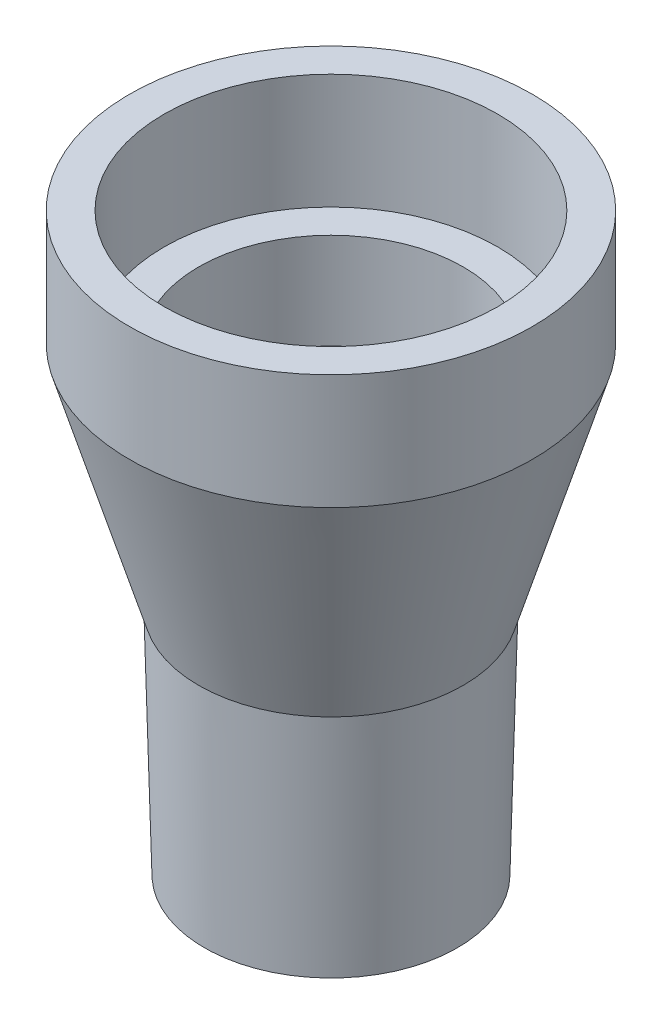
from build123d import *


with BuildPart() as part:
    # Sketch1 → Revolve1 (revolve)
    with BuildSketch(Plane.XY, mode=Mode.PRIVATE) as revolve1_sk:
        Polygon((14.5, 40), (14.5, 50), (17.5, 50), (17.5, 40), (11.5, 20), (11, 0), (8, 0), (8, 20), (11.5, 31.666666667), (11.5, 40), align=None)
    revolve(revolve1_sk.sketch.rotate(Axis((0, 0, 0), (0, 1, 0)), 90), axis=Axis((0, 0, 0), (0, 1, 0)))


solid = part.part
